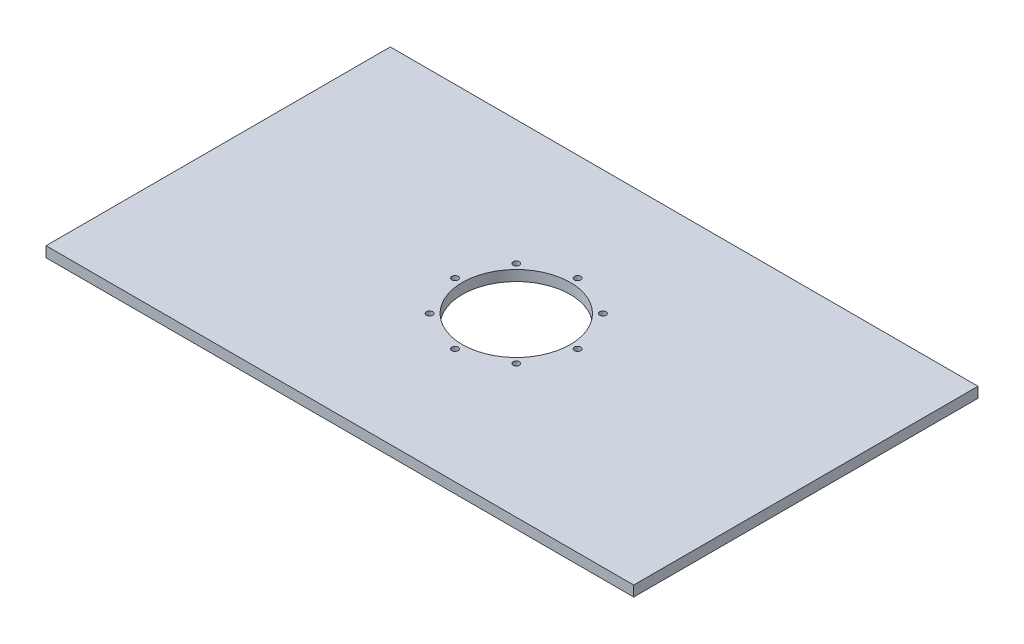
from build123d import *

# Parameters (mm, degrees)
SKETCH1_W           = 169
SKETCH1_H           = 99
SKETCH1_R           = 15.5
SKETCH1_R_2         = 0.905
BOSS_EXTRUDE4_DEPTH = 3


with BuildPart() as part:
    # Sketch1 → Boss-Extrude4 (new body)
    with BuildSketch(Plane(origin=(0, 0, 0), x_dir=(1, 0, 0), z_dir=(0, 1, 0))):
        with Locations((84.5, 49.5)):
            Rectangle(SKETCH1_W, SKETCH1_H)
        with Locations(Location((84.5, 50.731867025, 0), (0, 0, 270))):
            Circle(SKETCH1_R, mode=Mode.SUBTRACT)
        with Locations(Location((84.5, 68.356867025, 0), (0, 0, 270))):
            Circle(SKETCH1_R_2, mode=Mode.SUBTRACT)
        with Locations(Location((96.962757018, 63.194624043, 0), (0, 0, 270))):
            Circle(SKETCH1_R_2, mode=Mode.SUBTRACT)
        with Locations(Location((102.125, 50.731867025, 0), (0, 0, 270))):
            Circle(SKETCH1_R_2, mode=Mode.SUBTRACT)
        with Locations(Location((96.962757018, 38.269110006, 0), (0, 0, 270))):
            Circle(SKETCH1_R_2, mode=Mode.SUBTRACT)
        with Locations(Location((84.5, 33.106867025, 0), (0, 0, 270))):
            Circle(SKETCH1_R_2, mode=Mode.SUBTRACT)
        with Locations(Location((72.037242982, 38.269110006, 0), (0, 0, 270))):
            Circle(SKETCH1_R_2, mode=Mode.SUBTRACT)
        with Locations(Location((66.875, 50.731867025, 0), (0, 0, 270))):
            Circle(SKETCH1_R_2, mode=Mode.SUBTRACT)
        with Locations(Location((72.037242982, 63.194624043, 0), (0, 0, 270))):
            Circle(SKETCH1_R_2, mode=Mode.SUBTRACT)
    extrude(amount=BOSS_EXTRUDE4_DEPTH)


solid = part.part
